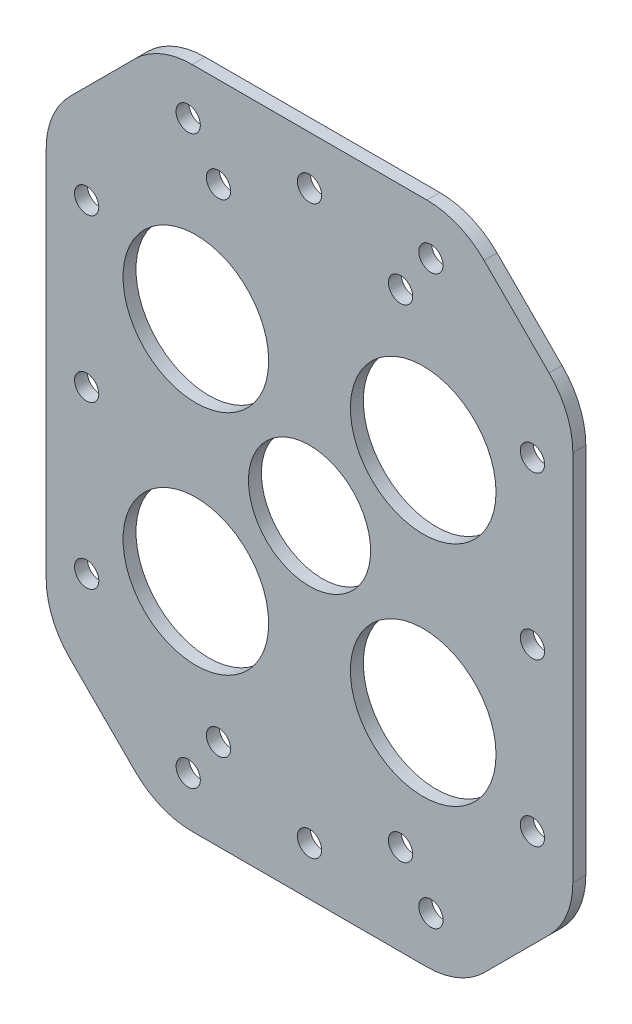
from build123d import *

# Parameters (mm, degrees)
IZIM1_R                     = 9
IZIM1_R_2                   = 7.55
IZIM1_R_3                   = 1.5
Y_KSEKLIK_EKSTR_ZYON1_DEPTH = 1.6


with BuildPart() as part:
    # Çizim1 → Yükseklik-Ekstrüzyon1 (new body)
    with BuildSketch(Plane.XY):
        with BuildLine():
            Line((2.928932188, -10.971067812), (10.971067812, -2.928932188))
            ThreePointArc((10.971067812, -2.928932188), (14.2153013, -0.761204675), (18.042135624, 0))
            Line((18.042135624, 0), (47.057864376, 0))
            ThreePointArc((47.057864376, 0), (50.8846987, -0.761204675), (54.128932188, -2.928932188))
            Line((54.128932188, -2.928932188), (62.171067812, -10.971067812))
            ThreePointArc((62.171067812, -10.971067812), (64.338795325, -14.2153013), (65.1, -18.042135624))
            Line((65.1, -18.042135624), (65.1, -64.057864376))
            ThreePointArc((65.1, -64.057864376), (64.338795325, -67.8846987), (62.171067812, -71.128932188))
            Line((62.171067812, -71.128932188), (54.128932188, -79.171067812))
            ThreePointArc((54.128932188, -79.171067812), (50.8846987, -81.338795325), (47.057864376, -82.1))
            Line((47.057864376, -82.1), (18.042135624, -82.1))
            ThreePointArc((18.042135624, -82.1), (14.2153013, -81.338795325), (10.971067812, -79.171067812))
            Line((10.971067812, -79.171067812), (2.928932188, -71.128932188))
            ThreePointArc((2.928932188, -71.128932188), (0.761204675, -67.8846987), (0, -64.057864376))
            Line((0, -64.057864376), (0, -18.042135624))
            ThreePointArc((0, -18.042135624), (0.761204675, -14.2153013), (2.928932188, -10.971067812))
        make_face()
        with Locations((18.5, -27)):
            Circle(IZIM1_R, mode=Mode.SUBTRACT)
        with Locations((46.6, -27)):
            Circle(IZIM1_R, mode=Mode.SUBTRACT)
        with Locations((18.5, -55.1)):
            Circle(IZIM1_R, mode=Mode.SUBTRACT)
        with Locations((46.6, -55.1)):
            Circle(IZIM1_R, mode=Mode.SUBTRACT)
        with Locations((32.55, -41.05)):
            Circle(IZIM1_R_2, mode=Mode.SUBTRACT)
        with Locations((32.55, -6)):
            Circle(IZIM1_R_3, mode=Mode.SUBTRACT)
        with Locations((47.55, -6)):
            Circle(IZIM1_R_3, mode=Mode.SUBTRACT)
        with Locations((43.8, -11.2)):
            Circle(IZIM1_R_3, mode=Mode.SUBTRACT)
        with Locations((17.55, -6)):
            Circle(IZIM1_R_3, mode=Mode.SUBTRACT)
        with Locations((21.3, -11.2)):
            Circle(IZIM1_R_3, mode=Mode.SUBTRACT)
        with Locations((5, -21.05)):
            Circle(IZIM1_R_3, mode=Mode.SUBTRACT)
        with Locations((60.1, -21.05)):
            Circle(IZIM1_R_3, mode=Mode.SUBTRACT)
        with Locations((5, -41.05)):
            Circle(IZIM1_R_3, mode=Mode.SUBTRACT)
        with Locations((60.1, -41.05)):
            Circle(IZIM1_R_3, mode=Mode.SUBTRACT)
        with Locations(Location((60.1, -61.05, 0), (0, 0, 180))):
            Circle(IZIM1_R_3, mode=Mode.SUBTRACT)
        with Locations(Location((32.55, -76.1, 0), (0, 0, 180))):
            Circle(IZIM1_R_3, mode=Mode.SUBTRACT)
        with Locations(Location((47.55, -76.1, 0), (0, 0, 180))):
            Circle(IZIM1_R_3, mode=Mode.SUBTRACT)
        with Locations(Location((43.8, -70.9, 0), (0, 0, 180))):
            Circle(IZIM1_R_3, mode=Mode.SUBTRACT)
        with Locations(Location((21.3, -70.9, 0), (0, 0, 180))):
            Circle(IZIM1_R_3, mode=Mode.SUBTRACT)
        with Locations(Location((17.55, -76.1, 0), (0, 0, 180))):
            Circle(IZIM1_R_3, mode=Mode.SUBTRACT)
        with Locations(Location((5, -61.05, 0), (0, 0, 180))):
            Circle(IZIM1_R_3, mode=Mode.SUBTRACT)
    extrude(amount=Y_KSEKLIK_EKSTR_ZYON1_DEPTH)


solid = part.part
